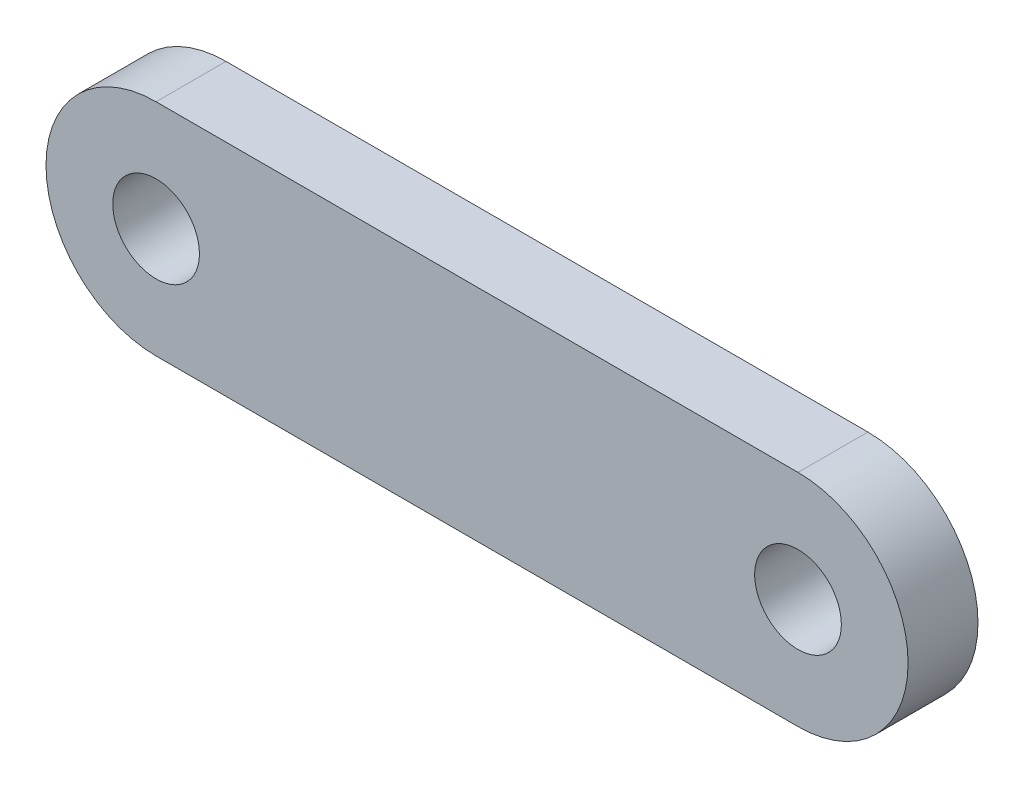
from build123d import *

# Parameters (mm, degrees)
SKETCH1_R           = 3.9375
BOSS_EXTRUDE1_DEPTH = 6.35


with BuildPart() as part:
    # Sketch1 → Boss-Extrude1 (new body)
    with BuildSketch(Plane.XY):
        with BuildLine():
            Line((-29.15466953, 10), (29.15466953, 10))
            ThreePointArc((29.15466953, 10), (39.15466953, 0), (29.15466953, -10))
            Line((29.15466953, -10), (-29.15466953, -10))
            ThreePointArc((-29.15466953, -10), (-39.15466953, 0), (-29.15466953, 10))
        make_face()
        with Locations((-29.15466953, 0)):
            Circle(SKETCH1_R, mode=Mode.SUBTRACT)
        with Locations((29.15466953, 0)):
            Circle(SKETCH1_R, mode=Mode.SUBTRACT)
    extrude(amount=BOSS_EXTRUDE1_DEPTH)


solid = part.part
